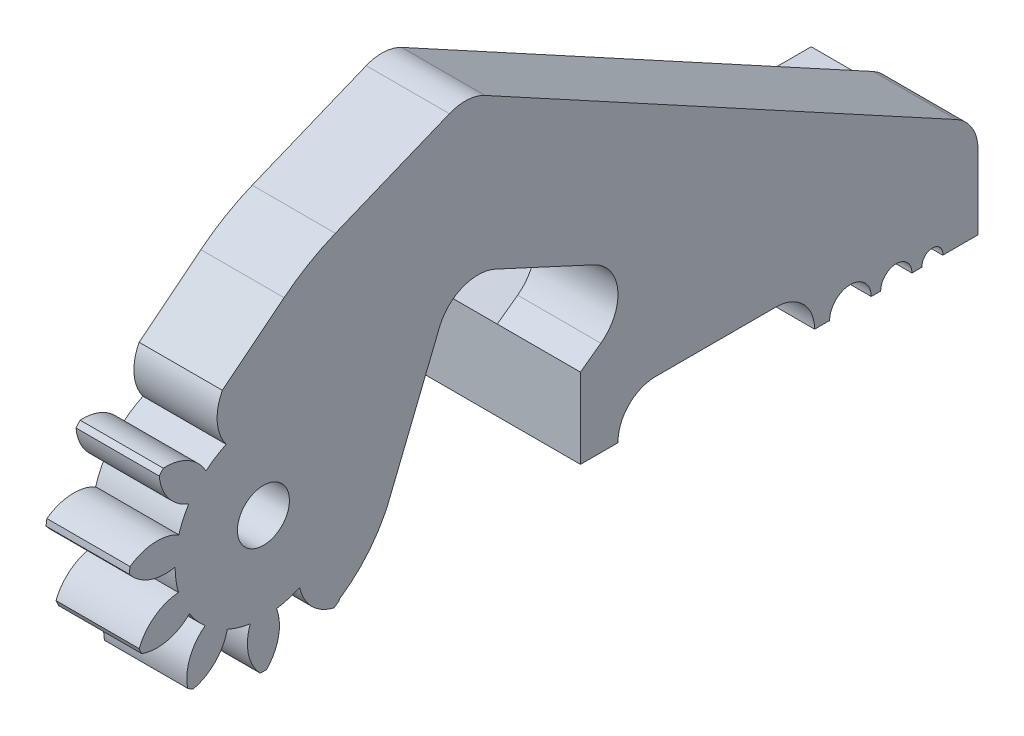
from build123d import *

# Parameters (mm, degrees)
BASPROSKE_W                 = 4
BASPROSKE_H                 = 6.5
TOOTHCUT_DEPTH              = 11.024968828
TEETHCUTS_COUNT             = 11
TEETHCUTS_ANGLE             = 327.272727273
BORSKE_R                    = 1.25
BORE_DEPTH                  = 62.5000635
Y_KSEKLIK_EKSTR_ZYON1_DEPTH = 4
Y_KSEKLIK_EKSTR_ZYON2_DEPTH = 4
RADYUS1_R                   = 10


with BuildPart() as part:
    # BasProSke → Base-Revolve (revolve)
    with BuildSketch(Plane(origin=(0, 0, 0), x_dir=(1, 0, 0), z_dir=(0, 1, 0)), mode=Mode.PRIVATE) as base_revolve_sk:
        with Locations((2, 3.25)):
            Rectangle(BASPROSKE_W, BASPROSKE_H)
    revolve(base_revolve_sk.sketch.rotate(Axis((-10, 0, 0), (1, 0, 0)), 180), axis=Axis((-10, 0, 0), (1, 0, 0)))

    # TooCutSke → ToothCut (cut, through all)
    with BuildSketch(Plane(origin=(0, 0, 0), x_dir=(0, 0, -1), z_dir=(1, 0, 0))):
        with BuildLine():
            ThreePointArc((0.576045815, 4.209771041), (0, 4.249), (-0.576045815, 4.209771041))
            ThreePointArc((-0.576045815, 4.209771041), (-0.841371334, 5.420048739), (-1.718652745, 6.295004202))
            ThreePointArc((-1.718652745, 6.295004202), (0, 6.5254), (1.718652745, 6.295004202))
            ThreePointArc((1.718652745, 6.295004202), (0.841371334, 5.420048739), (0.576045815, 4.209771041))
        make_face()
    toothcut = extrude(amount=TOOTHCUT_DEPTH, mode=Mode.SUBTRACT)

    # TeethCuts: ToothCut ×11 about axis
    teethcuts_axis = Axis((-10, 0, 0), (1, 0, 0))
    for i in range(1, TEETHCUTS_COUNT):
        add(toothcut.rotate(teethcuts_axis, i * TEETHCUTS_ANGLE / (TEETHCUTS_COUNT - 1)), mode=Mode.SUBTRACT)

    # BorSke → Bore (cut, symmetric)
    with BuildSketch(Plane(origin=(0, 0, 0), x_dir=(0, 0, -1), z_dir=(1, 0, 0))):
        with Locations(Location((0, 0, 0), (0, 0, 180))):
            Circle(BORSKE_R)
    extrude(amount=BORE_DEPTH, both=True, mode=Mode.SUBTRACT)

    # Çizim1 → Yükseklik-Ekstrüzyon1 (add)
    with BuildSketch(Plane(origin=(4, 0, 0), x_dir=(0, 0, -1), z_dir=(1, 0, 0))):
        with BuildLine():
            Line((2.760779628, -3.22987567), (1.236039076, 1.290267465))
            Line((1.236039076, 1.290267465), (-1.738987524, 3.876844515))
            ThreePointArc((-1.738987524, 3.876844515), (-2.188277705, 5.001068805), (-1.97474715, 6.192767854))
            Line((-1.97474715, 6.192767854), (2.120750073, 9.468090654))
            Line((2.120750073, 9.468090654), (8.9405865, 12.251804864))
            ThreePointArc((8.9405865, 12.251804864), (9.807212476, 12.397047884), (10.652448939, 12.156815828))
            Line((10.652448939, 12.156815828), (33.309678392, -0.173886099))
            ThreePointArc((33.309678392, -0.173886099), (34.072949781, -0.908840205), (34.353634969, -1.930582137))
            Line((34.353634969, -1.930582137), (34.353634969, -5.5))
            Line((34.353634969, -5.5), (32.660479675, -5.5))
            ThreePointArc((32.660479675, -5.5), (32.162954251, -4.950316473), (31.665428827, -5.5))
            Line((31.665428827, -5.5), (31.175724059, -5.5))
            ThreePointArc((31.175724059, -5.5), (30.425852071, -4.73614356), (29.675980082, -5.5))
            Line((29.675980082, -5.5), (29.219830425, -5.5))
            ThreePointArc((29.219830425, -5.5), (28.219830425, -4.5), (27.219830425, -5.5))
            Line((27.219830425, -5.5), (26.498039052, -5.5))
            ThreePointArc((26.498039052, -5.5), (25.955354116, -4.189842668), (24.645196784, -3.647157732))
            Line((24.645196784, -3.647157732), (18.851825021, -3.647157732))
            ThreePointArc((18.851825021, -3.647157732), (17.559352829, -4.192979175), (17.049350889, -5.5))
            Line((17.049350889, -5.5), (15.2413188, -5.5))
            Line((15.2413188, -5.5), (15.2413188, -1.657187873))
            Line((15.2413188, -1.657187873), (16.22148633, -0.944515231))
            ThreePointArc((16.22148633, -0.944515231), (17.0357361, 0.868792159), (15.883922648, 2.488795908))
            Line((15.883922648, 2.488795908), (11.157138105, 4.671882096))
            ThreePointArc((11.157138105, 4.671882096), (9.616505575, 4.728916331), (8.493027441, 3.673170916))
            Line((8.493027441, 3.673170916), (5.962652768, -2.587812197))
            ThreePointArc((5.962652768, -2.587812197), (4.998691965, -4.113179975), (3.652524478, -5.314762425))
            ThreePointArc((3.652524478, -5.314762425), (2.917345271, -4.39606094), (2.760779628, -3.22987567))
        make_face()
    extrude(amount=-Y_KSEKLIK_EKSTR_ZYON1_DEPTH)

    # Çizim2 → Yükseklik-Ekstrüzyon2 (add)
    with BuildSketch(Plane.ZY):
        with BuildLine():
            Line((-34.353634969, -1.930582137), (-34.353634969, -5.5))
            Line((-34.353634969, -5.5), (-32.660479675, -5.5))
            ThreePointArc((-32.660479675, -5.5), (-32.162954251, -4.950316473), (-31.665428827, -5.5))
            Line((-31.665428827, -5.5), (-31.175724059, -5.5))
            ThreePointArc((-31.175724059, -5.5), (-30.425852071, -4.73614356), (-29.675980082, -5.5))
            Line((-29.675980082, -5.5), (-29.219830425, -5.5))
            ThreePointArc((-29.219830425, -5.5), (-28.219830425, -4.5), (-27.219830425, -5.5))
            Line((-27.219830425, -5.5), (-26.498039052, -5.5))
            ThreePointArc((-26.498039052, -5.5), (-25.955354116, -4.189842668), (-24.645196784, -3.647157732))
            Line((-24.645196784, -3.647157732), (-18.851825021, -3.647157732))
            ThreePointArc((-18.851825021, -3.647157732), (-17.559352829, -4.192979175), (-17.049350889, -5.5))
            Line((-17.049350889, -5.5), (-15.2413188, -5.5))
            Line((-15.2413188, -5.5), (-15.2413188, -1.657187873))
            Line((-15.2413188, -1.657187873), (-34.334860745, -1.657187873))
            ThreePointArc((-34.334860745, -1.657187873), (-34.348935892, -1.793563074), (-34.353634969, -1.930582137))
        make_face()
    extrude(amount=Y_KSEKLIK_EKSTR_ZYON2_DEPTH)

    # Radyus1
    radyus1_edges = [part.edges().sort_by_distance(p)[0] for p in [
        (2, 9.468090654, -2.120750073),
    ]]
    fillet(radyus1_edges, radius=RADYUS1_R)


solid = part.part
